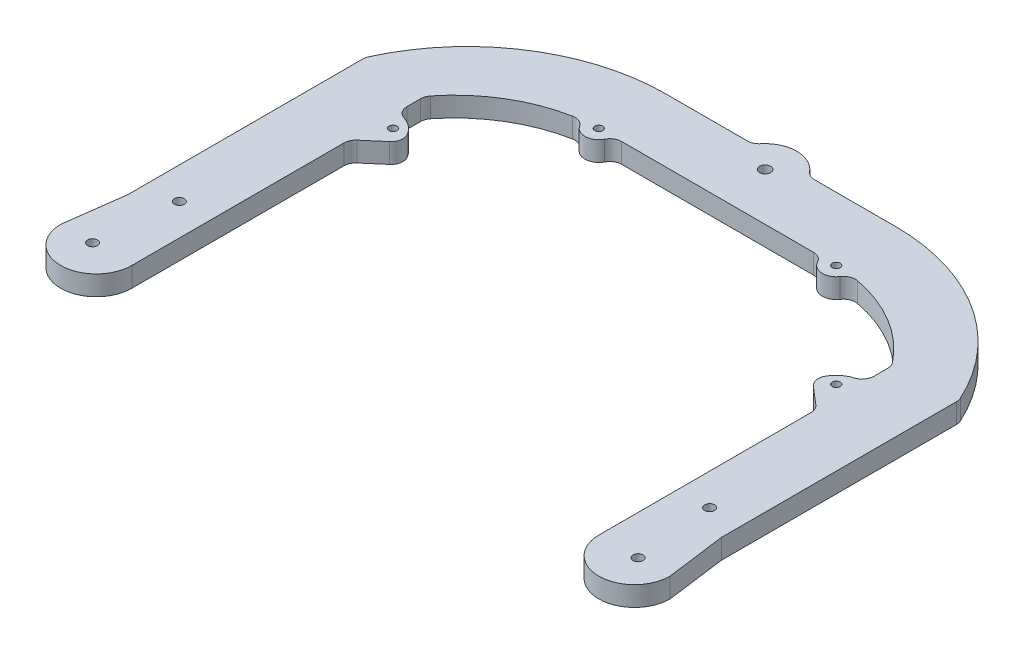
from build123d import *

# Parameters (mm, degrees)
SKETCH1_R                  = 1.25
BOSS_EXTRUDE1_DEPTH        = 5
BOSS_EXTRUDE2_START        = -5
BOSS_EXTRUDE2_DEPTH        = 5
F_2_0_2_DIAMETER_HOLE2_D   = 2
FILLET2_R                  = 3
F_2_8_2_8_DIAMETER_HOLE1_D = 2.8


with BuildPart() as part:
    # Sketch1 → Boss-Extrude1 (new body)
    with BuildSketch(Plane(origin=(0, 0, 0), x_dir=(1, 0, 0), z_dir=(0, 1, 0))):
        with BuildLine():
            Line((29, 74), (-29, 74))
            ThreePointArc((-29, 74), (-45.770509831, 70.041019662), (-59, 59))
            Line((-59, 59), (-59, 0))
            Line((-59, 0), (-59, -15))
            ThreePointArc((-59, -15), (-67.992720962, -23.992720962), (-76.985441925, -15))
            Line((-76.985441925, -15), (-75, 0))
            Line((-75, 0), (-75, 60))
            ThreePointArc((-75, 60), (-56.459060435, 81.837226001), (-29, 90))
            Line((-29, 90), (29, 90))
            ThreePointArc((29, 90), (56.459060435, 81.837226001), (75, 60))
            Line((75, 60), (75, 0))
            Line((75, 0), (76.985441925, -15))
            ThreePointArc((76.985441925, -15), (67.992720962, -23.992720962), (59, -15))
            Line((59, -15), (59, 0))
            Line((59, 0), (59, 59))
            ThreePointArc((59, 59), (45.770509831, 70.041019662), (29, 74))
        make_face()
        with Locations(Location((67, 5, 0), (0, 0, 270))):
            Circle(SKETCH1_R, mode=Mode.SUBTRACT)
        with Locations(Location((68.915666574, -15, 0), (0, 0, 270))):
            Circle(SKETCH1_R, mode=Mode.SUBTRACT)
        with Locations(Location((-68.915666574, -15, 0), (0, 0, 90))):
            Circle(SKETCH1_R, mode=Mode.SUBTRACT)
        with Locations(Location((-67, 5, 0), (0, 0, 90))):
            Circle(SKETCH1_R, mode=Mode.SUBTRACT)
    extrude(amount=BOSS_EXTRUDE1_DEPTH)

    # Sketch2 → Boss-Extrude2 (add)
    with BuildSketch(Plane(origin=(0, 5, 0), x_dir=(1, 0, 0), z_dir=(0, 1, 0)).offset(BOSS_EXTRUDE2_START)):
        with BuildLine():
            Line((52, 45.986664295), (59, 39.986664295))
            Line((59, 39.986664295), (59, 51.986664295))
            ThreePointArc((59, 51.986664295), (54.390227771, 50.281398562), (52, 45.986664295))
        make_face()
        with BuildLine():
            ThreePointArc((26.500025406, 74), (29.864997094, 70.489268948), (33.490587946, 73.730157398))
            ThreePointArc((33.490587946, 73.730157398), (31.249344079, 73.932478561), (29, 74))
            Line((29, 74), (26.500025406, 74))
        make_face()
        with BuildLine():
            ThreePointArc((-33.490587946, 73.730157398), (-29.864997094, 70.489268948), (-26.500025406, 74))
            Line((-26.500025406, 74), (-29, 74))
            ThreePointArc((-29, 74), (-31.249344079, 73.932478561), (-33.490587946, 73.730157398))
        make_face()
        with BuildLine():
            Line((-6.92820323, 90), (6.92820323, 90))
            ThreePointArc((6.92820323, 90), (0, 94), (-6.92820323, 90))
        make_face()
        with BuildLine():
            ThreePointArc((-52, 45.986664295), (-54.390227771, 50.281398562), (-59, 51.986664295))
            Line((-59, 51.986664295), (-59, 39.986664295))
            Line((-59, 39.986664295), (-52, 45.986664295))
        make_face()
    extrude(amount=BOSS_EXTRUDE2_DEPTH)

    # Ø2.0 (2) Diameter Hole2 (through all)
    with Locations(Plane(origin=(0, 5, 0), x_dir=(1, 0, 0), z_dir=(0, 1, 0))):
        with Locations((30, 73.986664295), (56, 47.986664295), (-30, 73.986664295), (-56, 47.986664295)):
            Hole(F_2_0_2_DIAMETER_HOLE2_D / 2)

    # Fillet2
    fillet2_edges = [part.edges().sort_by_distance(p)[0] for p in [
        (52, 2.5, -45.986664295),
        (59, 2.5, -51.986664295),
        (59, 2.5, -39.986664295),
        (59, 2.5, -59),
        (-59, 2.5, -59),
        (-75, 2.5, -60),
        (75, 2.5, -60),
        (-6.92820323, 2.5, -90),
        (6.92820323, 2.5, -90),
        (-26.500025406, 2.5, -74),
        (-33.490587946, 2.5, -73.730157398),
        (-52, 2.5, -45.986664295),
        (-59, 2.5, -39.986664295),
        (-59, 2.5, -51.986664295),
        (26.500025406, 2.5, -74),
        (33.490587946, 2.5, -73.730157398),
    ]]
    fillet(fillet2_edges, radius=FILLET2_R)

    # Ø2.8 (2.8) Diameter Hole1 (through all)
    with Locations(Plane(origin=(0, 5, 0), x_dir=(1, 0, 0), z_dir=(0, 1, 0))):
        with Locations((0, 86)):
            Hole(F_2_8_2_8_DIAMETER_HOLE1_D / 2)


solid = part.part
